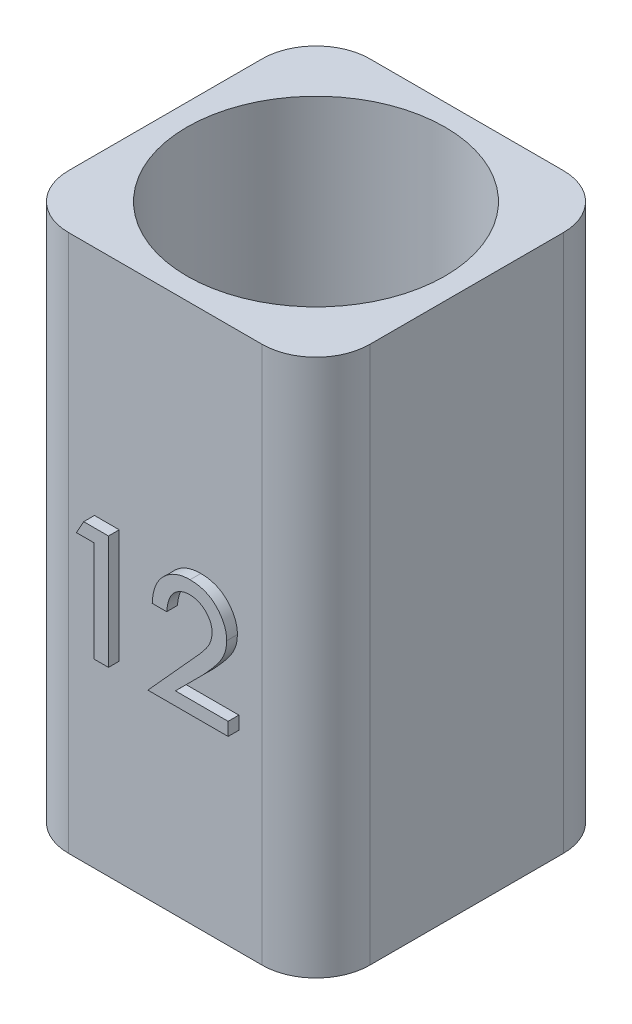
from build123d import *

# Parameters (mm, degrees)
SKETCH1_W           = 14
SKETCH1_H           = 14
BOSS_EXTRUDE1_DEPTH = 25
SKETCH2_R           = 6
CUT_EXTRUDE1_DEPTH  = 24
BOSS_EXTRUDE3_DEPTH = 0.5
FILLET1_R           = 2.5
FILLET2_R           = 2.5
FILLET3_R           = 2.5
FILLET4_R           = 2.5


with BuildPart() as part:
    # Sketch1 → Boss-Extrude1 (new body)
    with BuildSketch(Plane(origin=(0, 0, 0), x_dir=(1, 0, 0), z_dir=(0, 1, 0))):
        Rectangle(SKETCH1_W, SKETCH1_H)
    extrude(amount=BOSS_EXTRUDE1_DEPTH)

    # Sketch2 → Cut-Extrude1 (cut)
    with BuildSketch(Plane(origin=(0, 25, 0), x_dir=(1, 0, 0), z_dir=(0, 1, 0))):
        with Locations(Location((0, 0, 0), (0, 0, 270))):
            Circle(SKETCH2_R)
    extrude(amount=-CUT_EXTRUDE1_DEPTH, mode=Mode.SUBTRACT)

    # Sketch3 → Boss-Extrude3 (add)
    with BuildSketch(Plane.XY.offset(7)):
        Polygon((-3.300679086, 14.210073329), (-2.149487179, 14.210073329), (-2.149487179, 8.918406662), (-2.827905982, 8.918406662), (-2.827905982, 13.599496406), (-3.642008546, 13.599496406), align=None)
        with BuildLine():
            Line((0.556767829, 12.514026321), (-0.114230768, 12.514026321))
            add(Edge.make_bspline(
                [(-0.114230768, 12.514026321), (-0.111078886, 12.582304036), (-0.104914236, 12.71584588), (-0.077540014, 12.910431266), (-0.033195725, 13.093780337), (0.02277613, 13.267447402), (0.097441024, 13.429261532), (0.183589376, 13.582043561), (0.287590231, 13.722591478), (0.405116879, 13.851127618), (0.532696206, 13.967907704), (0.66984458, 14.068604955), (0.814243771, 14.154413881), (0.965922174, 14.224434532), (1.125176835, 14.278650186), (1.291553818, 14.318101559), (1.465583884, 14.341830622), (1.584215771, 14.344436169), (1.644357974, 14.34575709)],
                knots=[0, 0, 0, 0, 1.154964179, 2.258951466, 3.315045469, 4.34063582, 5.337653555, 6.322213479, 7.300594401, 8.285733883, 9.262436119, 10.219305053, 11.156568068, 12.097250375, 13.037875795, 13.995471444, 14.983774372, 16, 16, 16, 16], degree=3))
            add(Edge.make_bspline(
                [(1.644357974, 14.34575709), (1.70732699, 14.344469016), (1.830889612, 14.34194146), (2.01082655, 14.31815685), (2.181120391, 14.279804182), (2.341820997, 14.227428226), (2.492635583, 14.157492683), (2.633861547, 14.073158132), (2.764141354, 13.971791047), (2.884420569, 13.858367608), (2.990658217, 13.73360089), (3.086612633, 13.605325884), (3.165928247, 13.470941026), (3.232374739, 13.332900213), (3.283506362, 13.190070488), (3.319615354, 13.043033103), (3.341259687, 12.891688146), (3.344213908, 12.789350264), (3.345705129, 12.73769252)],
                knots=[0, 0, 0, 0, 1.156722346, 2.269809107, 3.328396062, 4.361258308, 5.3694338, 6.377253737, 7.377324894, 8.397019439, 9.4098266, 10.385180797, 11.337325354, 12.27255833, 13.196816462, 14.119704983, 15.050871513, 16, 16, 16, 16], degree=3))
            add(Edge.make_bspline(
                [(3.345705129, 12.73769252), (3.342991558, 12.665431813), (3.337601589, 12.521900312), (3.29609716, 12.309553694), (3.226323351, 12.104046507), (3.145727927, 11.936709759), (3.064215379, 11.80144908), (2.989411872, 11.689803537), (2.901537104, 11.569080813), (2.798706557, 11.440089036), (2.685009192, 11.299876822), (2.555928501, 11.152061213), (2.415459729, 10.993649578), (2.315279585, 10.886982507), (2.263415132, 10.831759694)],
                knots=[0, 0, 0, 0, 1.155755081, 2.295677249, 3.447123235, 4.6205014, 5.259503175, 5.973005395, 6.77029923, 7.648035671, 8.612336498, 9.658570495, 10.787814065, 12, 12, 12, 12], degree=3))
            Line((2.263415132, 10.831759694), (0.961699053, 9.528983586))
            Line((0.961699053, 9.528983586), (3.413547009, 9.528983586))
            Line((3.413547009, 9.528983586), (3.413547009, 8.918406662))
            Line((3.413547009, 8.918406662), (-0.317756409, 8.918406662))
            Line((-0.317756409, 8.918406662), (1.706899707, 11.154008626))
            add(Edge.make_bspline(
                [(1.706899707, 11.154008626), (1.755124332, 11.205439648), (1.847668268, 11.304136719), (1.978095845, 11.448613384), (2.095770717, 11.582179805), (2.201320257, 11.704739563), (2.29198055, 11.81793999), (2.370190541, 11.92011571), (2.435064878, 12.011749217), (2.502437185, 12.119609483), (2.569196231, 12.248904612), (2.625986943, 12.406626513), (2.660064153, 12.567694788), (2.664877757, 12.676053287), (2.667286326, 12.730272314)],
                knots=[0, 0, 0, 0, 1.341560447, 2.574479018, 3.703506985, 4.728875774, 5.651874962, 6.462761537, 7.177175968, 7.787249671, 8.88179658, 9.938774664, 10.968630673, 12, 12, 12, 12], degree=3))
            add(Edge.make_bspline(
                [(2.667286326, 12.730272314), (2.666692753, 12.763907746), (2.66551825, 12.830462259), (2.649505827, 12.927923363), (2.626949455, 13.022455211), (2.592062636, 13.112538015), (2.550030438, 13.199944057), (2.497455636, 13.283543423), (2.434322648, 13.362560638), (2.36409314, 13.43877354), (2.286417458, 13.507585159), (2.204373375, 13.569299116), (2.116951948, 13.619418877), (2.026543408, 13.663249485), (1.930337353, 13.694322519), (1.830698643, 13.717457991), (1.726844914, 13.733484398), (1.656080047, 13.734607291), (1.619977298, 13.735180167)],
                knots=[0, 0, 0, 0, 0.999432927, 1.977580462, 2.931018689, 3.885672852, 4.844657058, 5.812871023, 6.815890212, 7.849665183, 8.891901864, 9.898878619, 10.897592748, 11.885014695, 12.882178885, 13.896915602, 14.927050508, 16, 16, 16, 16], degree=3))
            add(Edge.make_bspline(
                [(1.619977298, 13.735180167), (1.585654597, 13.734476202), (1.518132832, 13.733091317), (1.41869032, 13.718802518), (1.32323782, 13.695537542), (1.23145333, 13.663266899), (1.14267207, 13.623454267), (1.059064891, 13.571877079), (0.979265259, 13.511876917), (0.902218203, 13.444535768), (0.832096498, 13.365531193), (0.76937784, 13.275799414), (0.71399479, 13.175242657), (0.666655887, 13.064036834), (0.627423824, 12.941890194), (0.595952005, 12.808951264), (0.571621246, 12.66516219), (0.561810561, 12.565336908), (0.556767829, 12.514026321)],
                knots=[0, 0, 0, 0, 0.911540883, 1.79324023, 2.663162255, 3.518366492, 4.375475705, 5.243419306, 6.122264358, 7.02676621, 7.957780629, 8.921596253, 9.930241338, 11.002848587, 12.128200329, 13.335197372, 14.630280975, 16, 16, 16, 16], degree=3))
        make_face()
    extrude(amount=BOSS_EXTRUDE3_DEPTH)

    # Fillet1
    fillet1_edges = [part.edges().sort_by_distance(p)[0] for p in [
        (-7, 12.5, 7),
    ]]
    fillet(fillet1_edges, radius=FILLET1_R)

    # Fillet2
    fillet2_edges = [part.edges().sort_by_distance(p)[0] for p in [
        (7, 12.5, 7),
    ]]
    fillet(fillet2_edges, radius=FILLET2_R)

    # Fillet3
    fillet3_edges = [part.edges().sort_by_distance(p)[0] for p in [
        (7, 12.5, -7),
    ]]
    fillet(fillet3_edges, radius=FILLET3_R)

    # Fillet4
    fillet4_edges = [part.edges().sort_by_distance(p)[0] for p in [
        (-7, 12.5, -7),
    ]]
    fillet(fillet4_edges, radius=FILLET4_R)


solid = part.part
